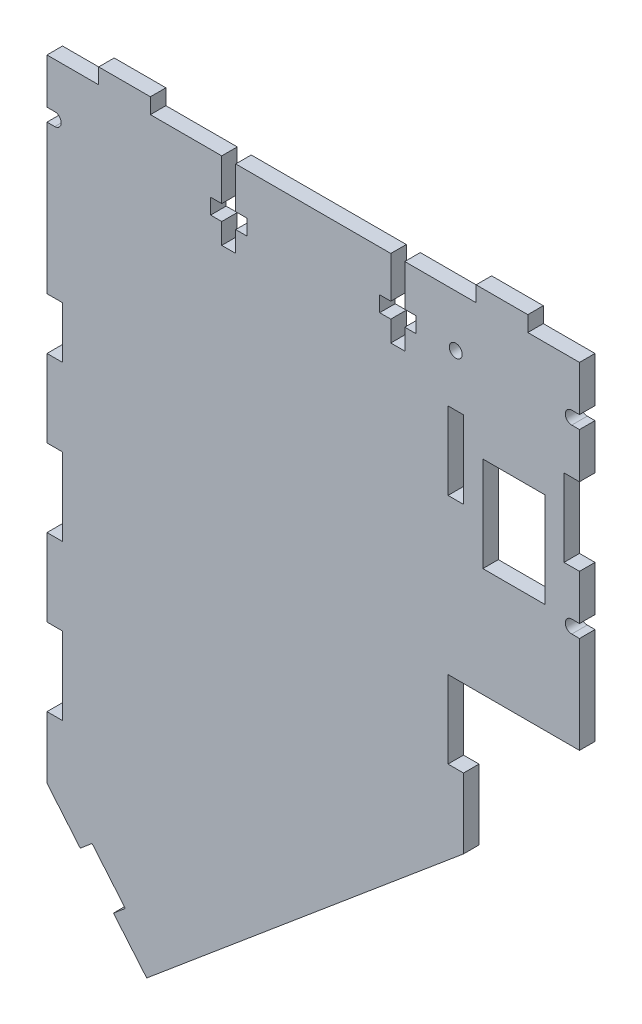
from build123d import *

# Parameters (mm, degrees)
CROQUIS1_W              = 3
CROQUIS1_H              = 15
CROQUIS1_R              = 1.25
SALIENTE_EXTRUIR1_DEPTH = 3
CROQUIS2_W              = 3
CROQUIS2_H              = 15
CORTAR_EXTRUIR1_DEPTH   = 3
CROQUIS3_W              = 10
CROQUIS3_H              = 3
SALIENTE_EXTRUIR2_DEPTH = 3
CROQUIS4_W              = 12
CROQUIS4_H              = 18.363871442
CORTAR_EXTRUIR2_DEPTH   = 3


with BuildPart() as part:
    # Croquis1 → Saliente-Extruir1 (new body)
    with BuildSketch(Plane.XY):
        with BuildLine():
            Line((103, 21.25), (103, 30))
            Line((103, 30), (69.2, 30))
            Line((69.2, 30), (69.2, 22))
            Line((69.2, 22), (71.35, 22))
            Line((71.35, 22), (71.35, 19))
            Line((71.35, 19), (69.2, 19))
            Line((69.2, 19), (69.2, 15))
            Line((69.2, 15), (66.5, 15))
            Line((66.5, 15), (66.5, 19))
            Line((66.5, 19), (64.35, 19))
            Line((64.35, 19), (64.35, 22))
            Line((64.35, 22), (66.5, 22))
            Line((66.5, 22), (66.5, 30))
            Line((66.5, 30), (36.5, 30))
            Line((36.5, 30), (36.5, 22))
            Line((36.5, 22), (38.65, 22))
            Line((38.65, 22), (38.65, 19))
            Line((38.65, 19), (36.5, 19))
            Line((36.5, 19), (36.5, 15))
            Line((36.5, 15), (33.8, 15))
            Line((33.8, 15), (33.8, 19))
            Line((33.8, 19), (31.65, 19))
            Line((31.65, 19), (31.65, 22))
            Line((31.65, 22), (33.8, 22))
            Line((33.8, 22), (33.8, 30))
            Line((33.8, 30), (0, 30))
            Line((0, 30), (0, 21.25))
            Line((0, 21.25), (1.5, 21.25))
            ThreePointArc((1.5, 21.25), (2.75, 20), (1.5, 18.75))
            Line((1.5, 18.75), (0, 18.75))
            Line((0, 18.75), (0, 0))
            Line((0, 0), (0, -10))
            Line((0, -10), (3, -10))
            Line((3, -10), (3, -20))
            Line((3, -20), (0, -20))
            Line((0, -20), (0, -35))
            Line((0, -35), (3, -35))
            Line((3, -35), (3, -50))
            Line((3, -50), (0, -50))
            Line((0, -50), (0, -65))
            Line((0, -65), (3, -65))
            Line((3, -65), (3, -80))
            Line((3, -80), (0, -80))
            Line((0, -80), (0, -92))
            Line((0, -92), (6.427876097, -99.660444431))
            Line((6.427876097, -99.660444431), (8.726009426, -97.732081602))
            Line((8.726009426, -97.732081602), (15.153885523, -105.392526033))
            Line((15.153885523, -105.392526033), (12.855752194, -107.320888862))
            Line((12.855752194, -107.320888862), (19.283628291, -114.981333294))
            Line((19.283628291, -114.981333294), (80.56718374, -63.558324519))
            Line((80.56718374, -63.558324519), (80.56718374, -50))
            Line((80.56718374, -50), (77.56718374, -50))
            Line((77.56718374, -50), (77.56718374, -35))
            Line((77.56718374, -35), (103, -35))
            Line((103, -35), (103, -16.25))
            Line((103, -16.25), (101.5, -16.25))
            ThreePointArc((101.5, -16.25), (100.25, -15), (101.5, -13.75))
            Line((101.5, -13.75), (103, -13.75))
            Line((103, -13.75), (103, 18.75))
            Line((103, 18.75), (101.5, 18.75))
            ThreePointArc((101.5, 18.75), (100.25, 20), (101.5, 21.25))
            Line((101.5, 21.25), (103, 21.25))
        make_face()
        with Locations((79.06718374, 2.5)):
            Rectangle(CROQUIS1_W, CROQUIS1_H, mode=Mode.SUBTRACT)
        with Locations((79.06718374, 20)):
            Circle(CROQUIS1_R, mode=Mode.SUBTRACT)
    extrude(amount=SALIENTE_EXTRUIR1_DEPTH)

    # Croquis2 → Cortar-Extruir1 (cut)
    with BuildSketch(Plane(origin=(103, 0, 0), x_dir=(0, 0, -1), z_dir=(1, 0, 0))):
        with Locations((-1.5, 2.5)):
            Rectangle(CROQUIS2_W, CROQUIS2_H)
    extrude(amount=-CORTAR_EXTRUIR1_DEPTH, mode=Mode.SUBTRACT)

    # Croquis3 → Saliente-Extruir2 (add)
    with BuildSketch(Plane.XY.offset(3)):
        with Locations((15, 31.5)):
            Rectangle(CROQUIS3_W, CROQUIS3_H)
        with Locations((88, 31.5)):
            Rectangle(CROQUIS3_W, CROQUIS3_H)
    extrude(amount=-SALIENTE_EXTRUIR2_DEPTH)

    # Croquis4 → Cortar-Extruir2 (cut)
    with BuildSketch(Plane.XY.offset(3)):
        with Locations((90.304087079, -4.709619469)):
            Rectangle(CROQUIS4_W, CROQUIS4_H)
    extrude(amount=-CORTAR_EXTRUIR2_DEPTH, mode=Mode.SUBTRACT)


solid = part.part
